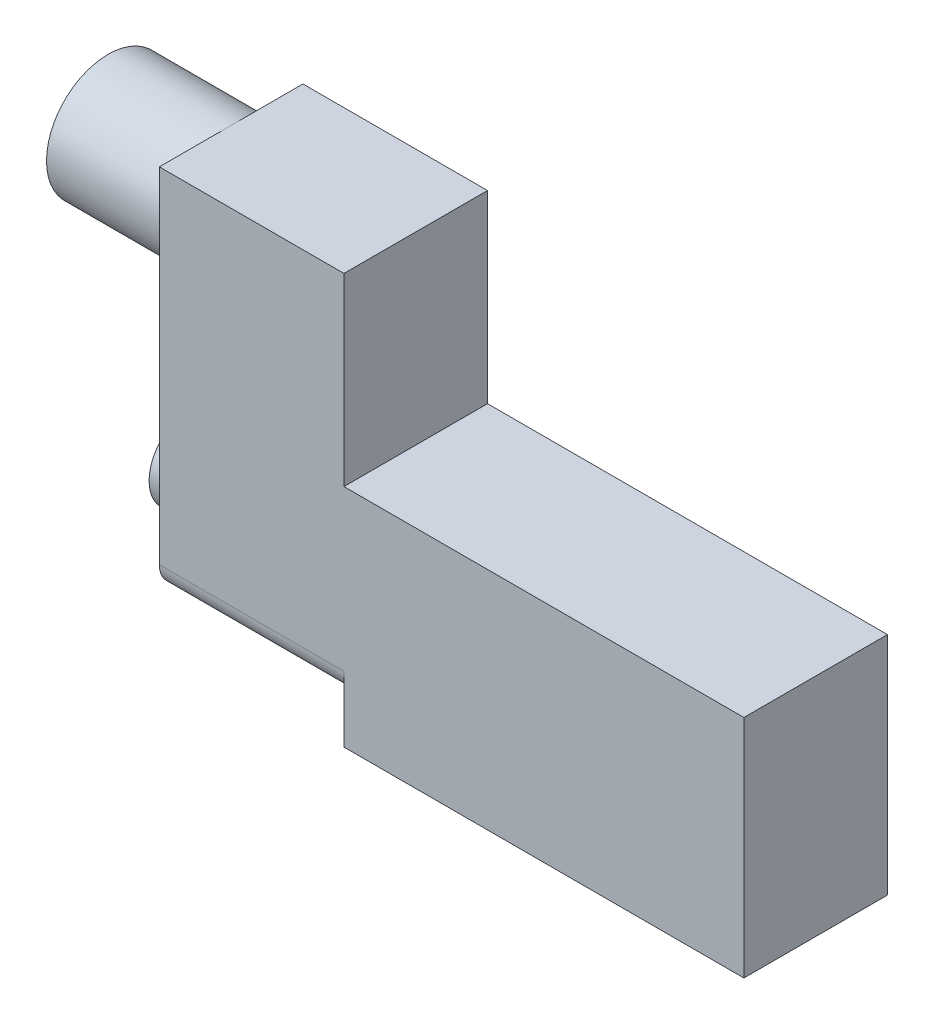
from build123d import *

# Parameters (mm, degrees)
SKETCH1_W           = 61.9125
SKETCH1_H           = 22.225
BOSS_EXTRUDE1_DEPTH = 34.925
SKETCH2_W           = 22.225
SKETCH2_H           = 28.575
BOSS_EXTRUDE2_DEPTH = 28.575
SKETCH3_W           = 28.575
SKETCH3_H           = 22.225
BOSS_EXTRUDE3_DEPTH = 28.575
SKETCH5_R           = 6.35
BOSS_EXTRUDE5_DEPTH = 6.35
FILLET1_R           = 3.81
SKETCH6_R           = 9.525
BOSS_EXTRUDE6_DEPTH = 19.05


with BuildPart() as part:
    # Sketch1 → Boss-Extrude1 (new body)
    with BuildSketch(Plane(origin=(0, 0, 0), x_dir=(1, 0, 0), z_dir=(0, 1, 0))):
        with Locations((30.95625, 11.1125)):
            Rectangle(SKETCH1_W, SKETCH1_H)
    extrude(amount=BOSS_EXTRUDE1_DEPTH)

    # Sketch2 → Boss-Extrude2 (add)
    with BuildSketch(Plane.ZY):
        with Locations((-11.1125, 20.6375)):
            Rectangle(SKETCH2_W, SKETCH2_H)
    extrude(amount=BOSS_EXTRUDE2_DEPTH)

    # Sketch3 → Boss-Extrude3 (add)
    with BuildSketch(Plane(origin=(0, 34.925, 0), x_dir=(1, 0, 0), z_dir=(0, 1, 0))):
        with Locations((-14.2875, 11.1125)):
            Rectangle(SKETCH3_W, SKETCH3_H)
    extrude(amount=BOSS_EXTRUDE3_DEPTH)

    # Sketch5 → Boss-Extrude5 (add)
    with BuildSketch(Plane.ZY.offset(28.575)):
        with Locations((-11.1125, 15.875)):
            Circle(SKETCH5_R)
    extrude(amount=BOSS_EXTRUDE5_DEPTH)

    # Fillet1
    fillet1_edges = [part.edges().sort_by_distance(p)[0] for p in [
        (-14.2875, 6.35, -22.225),
        (-14.2875, 6.35, 0),
    ]]
    fillet(fillet1_edges, radius=FILLET1_R)

    # Sketch6 → Boss-Extrude6 (add)
    with BuildSketch(Plane.ZY.offset(28.575)):
        with Locations(Location((-11.1125, 53.975, 0), (0, 0, 90))):
            Circle(SKETCH6_R)
    extrude(amount=BOSS_EXTRUDE6_DEPTH)


solid = part.part
